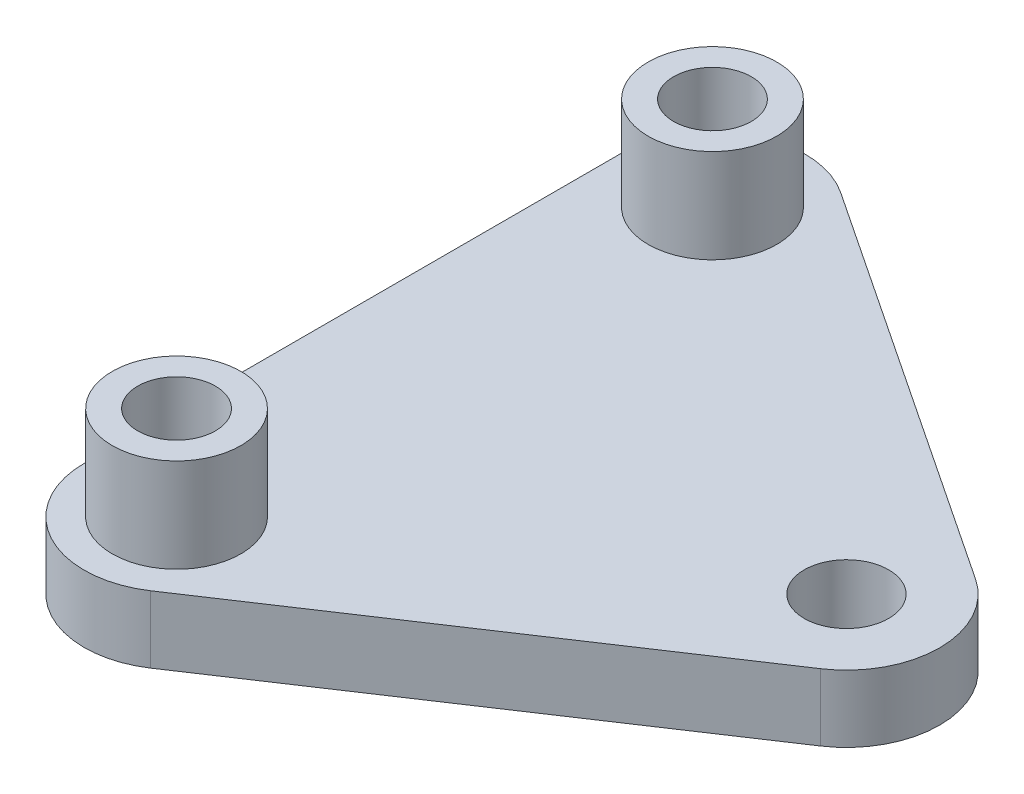
from build123d import *

# Parameters (mm, degrees)
CROQUIS2_R              = 1.45
SALIENTE_EXTRUIR1_DEPTH = 2.5
CROQUIS3_R              = 2.4
CROQUIS3_R_2            = 1.45
SALIENTE_EXTRUIR2_DEPTH = 3.5
CROQUIS4_R              = 1.575
CORTAR_EXTRUIR1_DEPTH   = 24.118782948


with BuildPart() as part:
    # Croquis2 → Saliente-Extruir1 (new body)
    with BuildSketch(Plane(origin=(0, 0, 0), x_dir=(1, 0, 0), z_dir=(0, 1, 0))):
        with BuildLine():
            Line((-3.45, 10), (-3.45, -10))
            ThreePointArc((-3.45, -10), (-1.630018545, -13.040647882), (1.909733068, -12.873224601))
            Line((1.909733068, -12.873224601), (16.923571713, -2.89404507))
            ThreePointArc((16.923571713, -2.89404507), (18.475, 0), (16.923571713, 2.89404507))
            Line((16.923571713, 2.89404507), (1.909733068, 12.873224601))
            ThreePointArc((1.909733068, 12.873224601), (-1.630018545, 13.040647882), (-3.45, 10))
        make_face()
        with Locations(Location((0, 10, 0), (0, 0, 270))):
            Circle(CROQUIS2_R, mode=Mode.SUBTRACT)
        with Locations(Location((0, -10, 0), (0, 0, 90))):
            Circle(CROQUIS2_R, mode=Mode.SUBTRACT)
    extrude(amount=SALIENTE_EXTRUIR1_DEPTH)

    # Croquis3 → Saliente-Extruir2 (add)
    # profile 1 of 2: a face of its own
    with BuildSketch(Plane(origin=(0, 2.5, 0), x_dir=(1, 0, 0), z_dir=(0, 1, 0))):
        with Locations(Location((0, 10, 0), (0, 0, 270))):
            Circle(CROQUIS3_R)
        with Locations(Location((0, 10, 0), (0, 0, 270))):
            Circle(CROQUIS3_R_2, mode=Mode.SUBTRACT)
    # profile 2 of 2: a face of its own
    with BuildSketch(Plane(origin=(0, 2.5, 0), x_dir=(1, 0, 0), z_dir=(0, 1, 0))):
        with Locations(Location((0, -10, 0), (0, 0, 270))):
            Circle(CROQUIS3_R)
        with Locations(Location((0, -10, 0), (0, 0, 90))):
            Circle(CROQUIS3_R_2, mode=Mode.SUBTRACT)
    extrude(amount=SALIENTE_EXTRUIR2_DEPTH)

    # Croquis4 → Cortar-Extruir1 (cut, through all)
    with BuildSketch(Plane(origin=(0, 2.5, 0), x_dir=(1, 0, 0), z_dir=(0, 1, 0))):
        with Locations(Location((15, 0, 0), (0, 0, 270))):
            Circle(CROQUIS4_R)
    extrude(amount=-CORTAR_EXTRUIR1_DEPTH, mode=Mode.SUBTRACT)


solid = part.part
